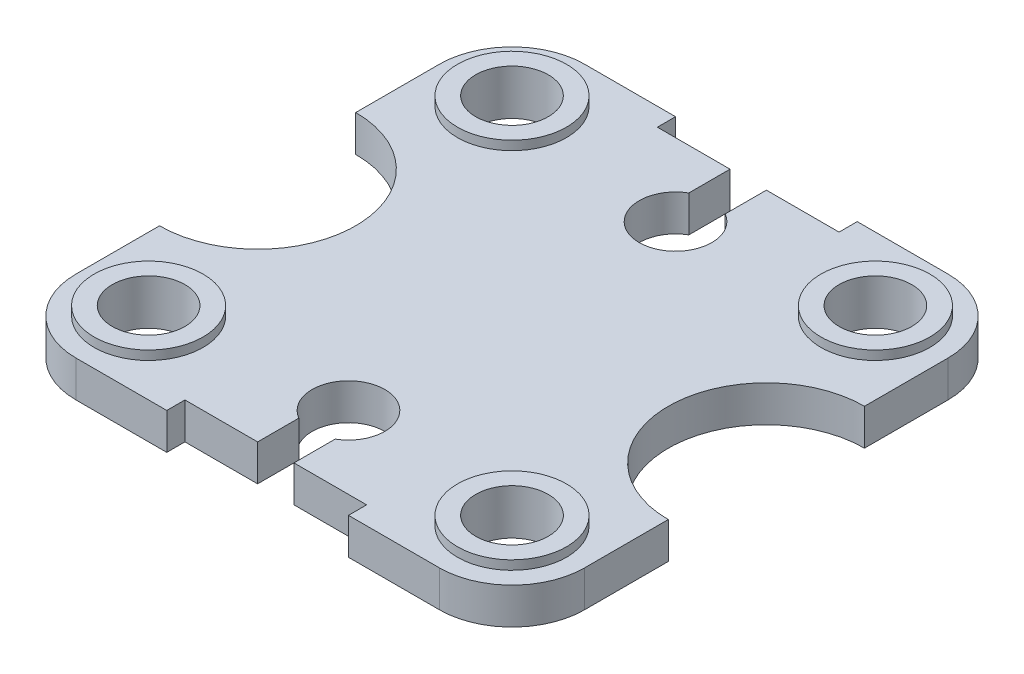
from build123d import *

# Parameters (mm, degrees)
SKETCH1_R           = 20
BOSS_EXTRUDE1_DEPTH = 20
SKETCH2_R           = 30
SKETCH2_R_2         = 20
BOSS_EXTRUDE2_DEPTH = 5


with BuildPart() as part:
    # Sketch1 → Boss-Extrude1 (new body)
    with BuildSketch(Plane(origin=(0, 0, 0), x_dir=(1, 0, 0), z_dir=(0, 1, 0))):
        with BuildLine():
            Line((-100, 140), (-50, 140))
            Line((-50, 140), (-50, 130))
            Line((-50, 130), (-10, 130))
            Line((-10, 130), (-10, 107.320508075))
            ThreePointArc((-10, 107.320508075), (0, 70), (10, 107.320508075))
            Line((10, 107.320508075), (10, 130))
            Line((10, 130), (50, 130))
            Line((50, 130), (50, 140))
            Line((50, 140), (100, 140))
            ThreePointArc((100, 140), (128.284271247, 128.284271247), (140, 100))
            Line((140, 100), (140, 54))
            ThreePointArc((140, 54), (86, 0), (140, -54))
            Line((140, -54), (140, -100))
            ThreePointArc((140, -100), (128.284271247, -128.284271247), (100, -140))
            Line((100, -140), (50, -140))
            Line((50, -140), (50, -130))
            Line((50, -130), (10, -130))
            Line((10, -130), (10, -107.320508076))
            ThreePointArc((10, -107.320508076), (0, -70), (-10, -107.320508076))
            Line((-10, -107.320508076), (-10, -130))
            Line((-10, -130), (-50, -130))
            Line((-50, -130), (-50, -140))
            Line((-50, -140), (-100, -140))
            ThreePointArc((-100, -140), (-128.284271247, -128.284271247), (-140, -100))
            Line((-140, -100), (-140, -54))
            ThreePointArc((-140, -54), (-86, 0), (-140, 54))
            Line((-140, 54), (-140, 100))
            ThreePointArc((-140, 100), (-128.284271247, 128.284271247), (-100, 140))
        make_face()
        with Locations(Location((-100, -100, 0), (0, 0, 270))):
            Circle(SKETCH1_R, mode=Mode.SUBTRACT)
        with Locations(Location((-100, 100, 0), (0, 0, 270))):
            Circle(SKETCH1_R, mode=Mode.SUBTRACT)
        with Locations(Location((100, 100, 0), (0, 0, 90))):
            Circle(SKETCH1_R, mode=Mode.SUBTRACT)
        with Locations(Location((100, -100, 0), (0, 0, 90))):
            Circle(SKETCH1_R, mode=Mode.SUBTRACT)
    extrude(amount=BOSS_EXTRUDE1_DEPTH)

    # Sketch2 → Boss-Extrude2 (add)
    # profile 1 of 4: a face of its own
    with BuildSketch(Plane(origin=(0, 20, 0), x_dir=(1, 0, 0), z_dir=(0, 1, 0))):
        with Locations(Location((-100, 100, 0), (0, 0, 270))):
            Circle(SKETCH2_R)
        with Locations(Location((-100, 100, 0), (0, 0, 270))):
            Circle(SKETCH2_R_2, mode=Mode.SUBTRACT)
    # profile 2 of 4: a face of its own
    with BuildSketch(Plane(origin=(0, 20, 0), x_dir=(1, 0, 0), z_dir=(0, 1, 0))):
        with Locations(Location((100, 100, 0), (0, 0, 90))):
            Circle(SKETCH2_R)
        with Locations(Location((100, 100, 0), (0, 0, 90))):
            Circle(SKETCH2_R_2, mode=Mode.SUBTRACT)
    # profile 3 of 4: a face of its own
    with BuildSketch(Plane(origin=(0, 20, 0), x_dir=(1, 0, 0), z_dir=(0, 1, 0))):
        with Locations(Location((100, -100, 0), (0, 0, 270))):
            Circle(SKETCH2_R)
        with Locations(Location((100, -100, 0), (0, 0, 90))):
            Circle(SKETCH2_R_2, mode=Mode.SUBTRACT)
    # profile 4 of 4: a face of its own
    with BuildSketch(Plane(origin=(0, 20, 0), x_dir=(1, 0, 0), z_dir=(0, 1, 0))):
        with Locations(Location((-100, -100, 0), (0, 0, 90))):
            Circle(SKETCH2_R)
        with Locations(Location((-100, -100, 0), (0, 0, 90))):
            Circle(SKETCH2_R_2, mode=Mode.SUBTRACT)
    extrude(amount=BOSS_EXTRUDE2_DEPTH)


solid = part.part
